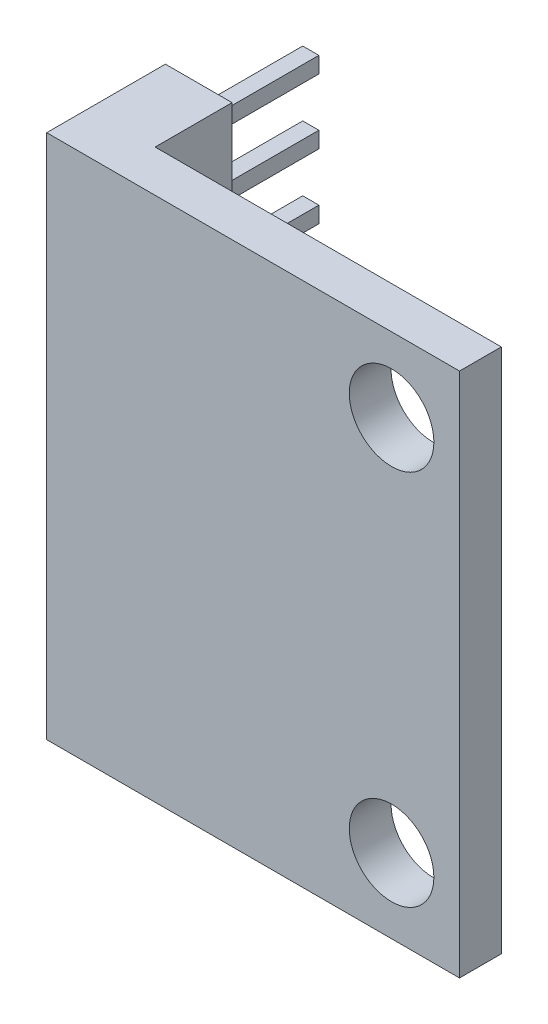
from build123d import *

# Parameters (mm, degrees)
SKETCH1_W               = 16.1
SKETCH1_H               = 20.5
BOSS_EXTRUDE1_DEPTH     = 1.63
CUT_EXTRUDE1_DEPTH      = 14.134759229
CUT_EXTRUDE1_DEPTH_BACK = 14.134759229
SKETCH2_R               = 1.65
SKETCH3_W               = 2.6
SKETCH3_H               = 20.5
BOSS_EXTRUDE2_DEPTH     = 3
SKETCH4_W               = 0.63
SKETCH4_H               = 0.63
BOSS_EXTRUDE3_DEPTH     = 4.37


with BuildPart() as part:
    # Sketch1 → Boss-Extrude1 (new body)
    with BuildSketch(Plane.XY):
        Rectangle(SKETCH1_W, SKETCH1_H)
    extrude(amount=BOSS_EXTRUDE1_DEPTH)

    # Sketch2 → Cut-Extrude1 (cut, two sides: drawn at the far end of the back side and taken through both)
    with BuildSketch(Plane.XY.offset(1.63).offset(-CUT_EXTRUDE1_DEPTH_BACK)):
        with Locations((5.4, 7.35)):
            Circle(SKETCH2_R)
        with Locations((5.4, -7.35)):
            Circle(SKETCH2_R)
    extrude(amount=CUT_EXTRUDE1_DEPTH + CUT_EXTRUDE1_DEPTH_BACK, mode=Mode.SUBTRACT)

    # Sketch3 → Boss-Extrude2 (add)
    with BuildSketch(Plane(origin=(0, 0, 0), x_dir=(-1, 0, 0), z_dir=(0, 0, -1))):
        with Locations((6.75, 0)):
            Rectangle(SKETCH3_W, SKETCH3_H)
    extrude(amount=BOSS_EXTRUDE2_DEPTH)

    # Sketch4 → Boss-Extrude3 (add)
    with BuildSketch(Plane(origin=(0, 0, -3), x_dir=(-1, 0, 0), z_dir=(0, 0, -1))):
        with Locations((6.75, 8.855)):
            Rectangle(SKETCH4_W, SKETCH4_H)
        with Locations((6.75, 6.325)):
            Rectangle(SKETCH4_W, SKETCH4_H)
        with Locations((6.75, 3.795)):
            Rectangle(SKETCH4_W, SKETCH4_H)
        with Locations((6.75, 1.265)):
            Rectangle(SKETCH4_W, SKETCH4_H)
        with Locations((6.75, -1.265)):
            Rectangle(SKETCH4_W, SKETCH4_H)
        with Locations((6.75, -3.795)):
            Rectangle(SKETCH4_W, SKETCH4_H)
        with Locations((6.75, -6.325)):
            Rectangle(SKETCH4_W, SKETCH4_H)
        with Locations((6.75, -8.855)):
            Rectangle(SKETCH4_W, SKETCH4_H)
    extrude(amount=BOSS_EXTRUDE3_DEPTH)


solid = part.part
